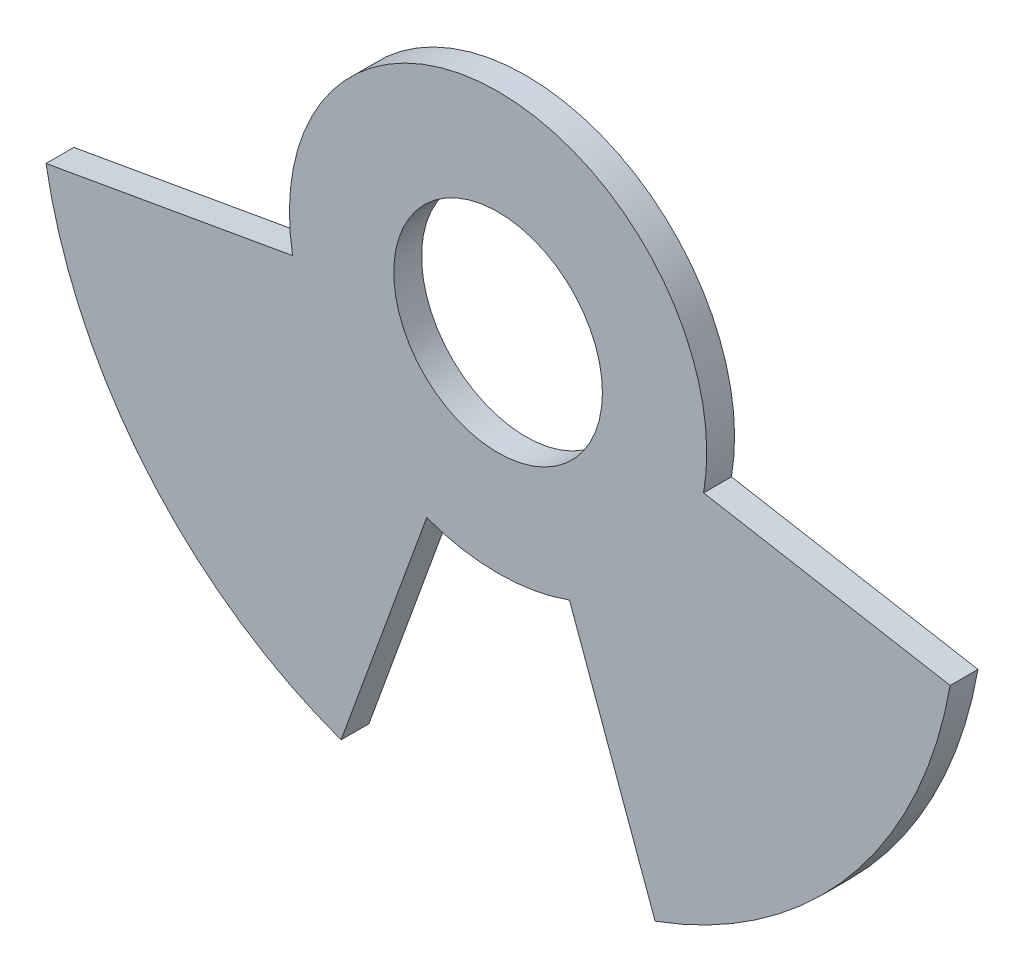
from build123d import *

# Parameters (mm, degrees)
SKETCH1_R           = 0.75
BOSS_EXTRUDE1_DEPTH = 0.2


with BuildPart() as part:
    # Sketch1 → Boss-Extrude1 (new body)
    with BuildSketch(Plane.XY):
        with BuildLine():
            Line((-0.513030215, -1.409538931), (-1.128666473, -3.100985649))
            ThreePointArc((-1.128666473, -3.100985649), (-2.527946662, -2.121199112), (-3.249865585, -0.573038986))
            Line((-3.249865585, -0.573038986), (-1.47721163, -0.260472267))
            ThreePointArc((-1.47721163, -0.260472267), (0, 1.5), (1.47721163, -0.260472267))
            Line((1.47721163, -0.260472267), (3.249865585, -0.573038986))
            ThreePointArc((3.249865585, -0.573038986), (2.527946662, -2.121199112), (1.128666473, -3.100985649))
            Line((1.128666473, -3.100985649), (0.513030215, -1.409538931))
            ThreePointArc((0.513030215, -1.409538931), (0, -1.5), (-0.513030215, -1.409538931))
        make_face()
        Circle(SKETCH1_R, mode=Mode.SUBTRACT)
    extrude(amount=BOSS_EXTRUDE1_DEPTH)


solid = part.part
